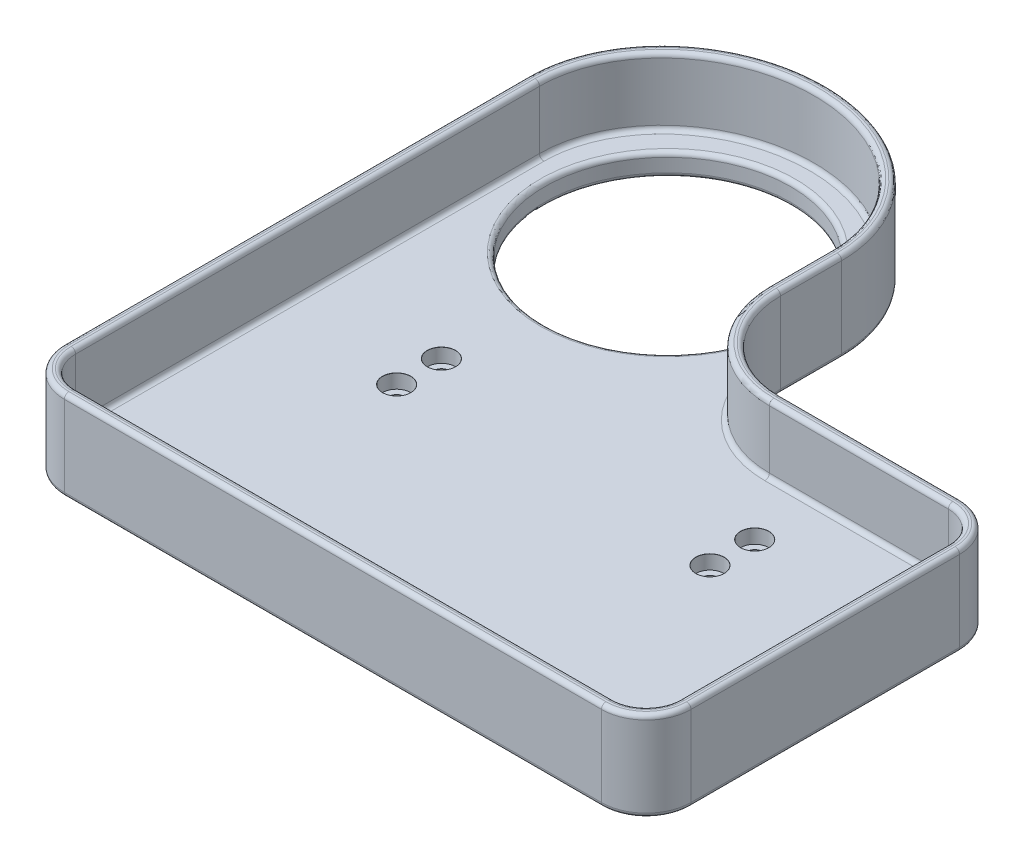
from build123d import *

# Parameters (mm, degrees)
SKETCH1_R                     = 34.925
BOSS_EXTRUDE1_DEPTH           = 6.35
BOSS_EXTRUDE2_DEPTH           = 19.05
FILLET1_R                     = 1.27
FILLET2_R                     = 1.27
FILLET3_R                     = 1.27
CBORE_FOR_M4_SHCS2_AT_2_COUNT = 2
CBORE_FOR_M4_SHCS2_AT_2_PITCH = 12.7
CBORE_FOR_M4_SHCS2_AT_3_COUNT = 2
CBORE_FOR_M4_SHCS2_AT_3_PITCH = 88.9
CBORE_FOR_M4_SHCS2_AT_4_COUNT = 2
CBORE_FOR_M4_SHCS2_AT_4_PITCH = 89.802561211


with BuildPart() as part:
    # Sketch1 → Boss-Extrude1 (new body)
    with BuildSketch(Plane(origin=(0, 0, 0), x_dir=(1, 0, 0), z_dir=(0, 1, 0))):
        with BuildLine():
            Line((-82.842872117, 42.730728121), (-82.842872117, 0))
            Line((-82.842872117, 0), (-82.842872117, -88.9))
            ThreePointArc((-82.842872117, -88.9), (-79.123128238, -97.880256121), (-70.142872117, -101.6))
            Line((-70.142872117, -101.6), (82.257127883, -101.6))
            ThreePointArc((82.257127883, -101.6), (91.237384004, -97.880256121), (94.957127883, -88.9))
            Line((94.957127883, -88.9), (94.957127883, -12.7))
            ThreePointArc((94.957127883, -12.7), (91.237384004, -3.719743879), (82.257127883, 0))
            Line((82.257127883, 0), (31.593871364, 0))
            Line((31.593871364, 0), (31.457127883, 0))
            ThreePointArc((31.457127883, 0), (13.49661564, 7.439487758), (6.057127883, 25.4))
            Line((6.057127883, 25.4), (6.057127883, 42.730728121))
            add(Edge.make_bspline(
                [(6.057127883, 42.730728121), (6.057127883, 82.55), (-38.392872117, 82.55), (-82.842872117, 82.55), (-82.842872117, 42.730728121)],
                knots=[3.141592654, 3.141592654, 3.141592654, 4.71238898, 4.71238898, 6.283185307, 6.283185307, 6.283185307], degree=2, weights=[1, 0.707106781, 1, 0.707106781, 1]))
        make_face()
        with Locations(Location((-38.392872117, 37.840394919, 0), (0, 0, 270))):
            Circle(SKETCH1_R, mode=Mode.SUBTRACT)
    extrude(amount=BOSS_EXTRUDE1_DEPTH)

    # Sketch2 → Boss-Extrude2 (add)
    with BuildSketch(Plane(origin=(0, 6.35, 0), x_dir=(1, 0, 0), z_dir=(0, 1, 0))):
        with BuildLine():
            Line((6.057127883, 25.4), (6.057127883, 42.730728121))
            add(Edge.make_bspline(
                [(6.057127883, 42.730728121), (6.057127883, 82.55), (-38.392872117, 82.55), (-82.842872117, 82.55), (-82.842872117, 42.730728121)],
                knots=[3.141592654, 3.141592654, 3.141592654, 4.71238898, 4.71238898, 6.283185307, 6.283185307, 6.283185307], degree=2, weights=[1, 0.707106781, 1, 0.707106781, 1]))
            Line((-82.842872117, 42.730728121), (-82.842872117, -88.9))
            ThreePointArc((-82.842872117, -88.9), (-79.123128238, -97.880256121), (-70.142872117, -101.6))
            Line((-70.142872117, -101.6), (82.257127883, -101.6))
            ThreePointArc((82.257127883, -101.6), (91.237384004, -97.880256121), (94.957127883, -88.9))
            Line((94.957127883, -88.9), (94.957127883, -12.7))
            ThreePointArc((94.957127883, -12.7), (91.237384004, -3.719743879), (82.257127883, 0))
            Line((82.257127883, 0), (31.457127883, 0))
            ThreePointArc((31.457127883, 0), (13.49661564, 7.439487758), (6.057127883, 25.4))
        make_face()
        with BuildLine():
            Line((-79.667872117, 42.730728121), (-79.667872117, -88.9))
            ThreePointArc((-79.667872117, -88.9), (-76.878064208, -95.635192091), (-70.142872117, -98.425))
            Line((-70.142872117, -98.425), (82.257127883, -98.425))
            ThreePointArc((82.257127883, -98.425), (88.992319973, -95.635192091), (91.782127883, -88.9))
            Line((91.782127883, -88.9), (91.782127883, -12.7))
            ThreePointArc((91.782127883, -12.7), (88.992319973, -5.964807909), (82.257127883, -3.175))
            Line((82.257127883, -3.175), (31.457127883, -3.175))
            ThreePointArc((31.457127883, -3.175), (11.25155161, 5.194423728), (2.882127883, 25.4))
            Line((2.882127883, 25.4), (2.882127883, 42.730728121))
            add(Edge.make_bspline(
                [(2.882127883, 42.730728121), (2.882127883, 47.479036255), (0.77957319, 56.97663779), (-8.301318843, 69.181527247), (-22.057140454, 77.431289343), (-38.392872117, 80.346855329), (-54.72860378, 77.431289343), (-68.484425392, 69.181527247), (-77.565317424, 56.97663779), (-79.667872117, 47.479036255), (-79.667872117, 42.730728121)],
                knots=[3.141592654, 3.141592654, 3.141592654, 3.141592654, 3.534291735, 3.926990817, 4.319689899, 4.71238898, 5.105088062, 5.497787144, 5.890486225, 6.283185307, 6.283185307, 6.283185307, 6.283185307], degree=3))
        make_face(mode=Mode.SUBTRACT)
    extrude(amount=BOSS_EXTRUDE2_DEPTH)

    # Fillet1
    fillet1_edges = [part.edges().sort_by_distance(p)[0] for p in [
        (13.49661564, 25.4, -7.439487758),
        (6.057127883, 25.4, -34.06536406),
        (-82.842872117, 25.4, 23.08463594),
        (-79.123128238, 25.4, 97.880256121),
        (6.057127883, 25.4, 101.6),
        (91.237384004, 25.4, 97.880256121),
        (94.957127883, 25.4, 50.8),
        (91.237384004, 25.4, 3.719743879),
        (56.857127883, 25.4, 0),
        (-79.667872117, 25.4, 23.08463594),
        (-76.878064208, 25.4, 95.635192091),
        (6.057127883, 25.4, 98.425),
        (88.992319973, 25.4, 95.635192091),
        (91.782127883, 25.4, 50.8),
        (88.992319973, 25.4, 5.964807909),
        (56.857127883, 25.4, 3.175),
        (11.25155161, 25.4, -5.194423728),
        (2.882127883, 25.4, -34.06536406),
    ]]
    fillet(fillet1_edges, radius=FILLET1_R)

    # Fillet2
    fillet2_edges = [part.edges().sort_by_distance(p)[0] for p in [
        (13.49661564, 0, -7.439487758),
        (56.857127883, 0, 0),
        (91.237384004, 0, 3.719743879),
        (94.957127883, 0, 50.8),
        (91.237384004, 0, 97.880256121),
        (6.057127883, 0, 101.6),
        (-79.123128238, 0, 97.880256121),
        (-82.842872117, 0, 23.08463594),
        (-38.392872117, 0, -82.55),
        (6.057127883, 0, -34.06536406),
        (-38.392872117, 6.35, -72.765394919),
        (-79.667872117, 6.35, 23.08463594),
        (-76.878064208, 6.35, 95.635192091),
        (6.057127883, 6.35, 98.425),
        (88.992319973, 6.35, 95.635192091),
        (91.782127883, 6.35, 50.8),
        (88.992319973, 6.35, 5.964807909),
        (56.857127883, 6.35, 3.175),
        (11.25155161, 6.35, -5.194423728),
        (2.882127883, 6.35, -34.06536406),
        (-38.392872117, 6.35, -72.765394919),
    ]]
    fillet(fillet2_edges, radius=FILLET2_R)

    # Fillet3
    fillet3_edges = [part.edges().sort_by_distance(p)[0] for p in [
        (-38.392872117, 0, -72.765394919),
    ]]
    fillet(fillet3_edges, radius=FILLET3_R)

    # Sketch7 → CBORE for M4 SHCS2 (revolve, cut)
    with BuildSketch(Plane(origin=(-44.45, 6.35, 20.32), x_dir=(0, 0, 1), z_dir=(1, 0, 0))):
        Polygon((0, 0), (0, 8.144033575), (2.15, 8.144033575), (2.15, 4), (4, 4), (4, 0.025), (4.025, 0), align=None)
    cbore_for_m4_shcs2 = revolve(axis=Axis((-44.45, 12.7, 20.32), (0, -1, 0)), mode=Mode.SUBTRACT)

    # CBORE for M4 SHCS2 at 2: CBORE for M4 SHCS2 ×2
    with Locations(*[(0, 0, i * CBORE_FOR_M4_SHCS2_AT_2_PITCH) for i in range(1, CBORE_FOR_M4_SHCS2_AT_2_COUNT)]):
        add(cbore_for_m4_shcs2, mode=Mode.SUBTRACT)

    # CBORE for M4 SHCS2 at 3: CBORE for M4 SHCS2 ×2
    with Locations(*[(i * CBORE_FOR_M4_SHCS2_AT_3_PITCH, 0, 0) for i in range(1, CBORE_FOR_M4_SHCS2_AT_3_COUNT)]):
        add(cbore_for_m4_shcs2, mode=Mode.SUBTRACT)

    # CBORE for M4 SHCS2 at 4: CBORE for M4 SHCS2 ×2
    with Locations(*[Vector(0.9899494936611666, 0, 0.14142135623730953) * (i * CBORE_FOR_M4_SHCS2_AT_4_PITCH) for i in range(1, CBORE_FOR_M4_SHCS2_AT_4_COUNT)]):
        add(cbore_for_m4_shcs2, mode=Mode.SUBTRACT)


solid = part.part
